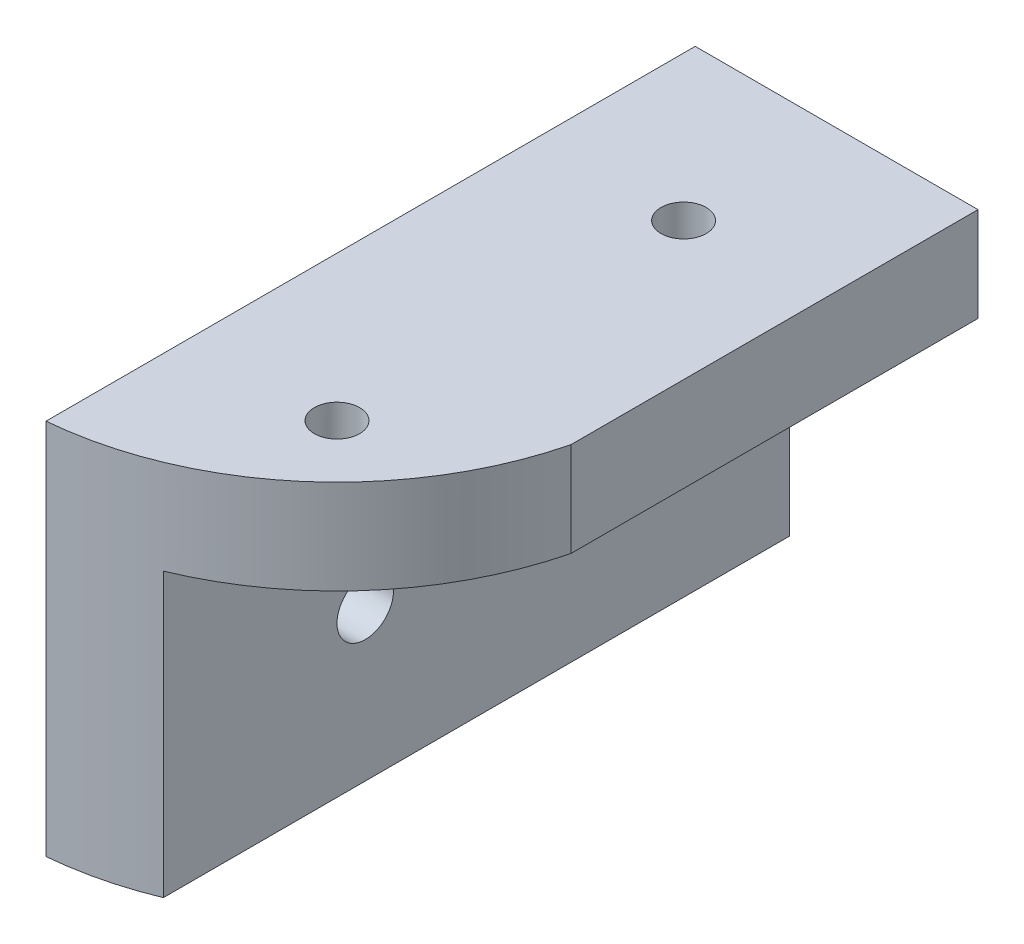
from build123d import *

# Parameters (mm, degrees)
BOSS_EXTRUDE1_DEPTH = 35
CUT_EXTRUDE1_REACH  = 42.927
SKETCH3_R           = 1.2
CUT_EXTRUDE2_REACH  = 43.533
SKETCH4_R           = 1.5
CUT_EXTRUDE4_REACH  = 45.012


with BuildPart() as part:
    # Sketch1 → Boss-Extrude1 (new body)
    with BuildSketch(Plane.XY):
        Polygon((0, 0), (0, 20), (15, 20), (15, 15), (5, 15), (5, 0), align=None)
    extrude(amount=BOSS_EXTRUDE1_DEPTH)

    # Sketch3 → Cut-Extrude1 (cut, up to next)
    with BuildSketch(Plane.XZ.offset(-15), mode=Mode.PRIVATE) as cut_extrude1_sk1:
        with Locations((7.692388155, 26.692388155)):
            Circle(SKETCH3_R)
    cut_extrude1_tool1 = extrude(cut_extrude1_sk1.sketch, amount=-CUT_EXTRUDE1_REACH, mode=Mode.PRIVATE) & part.part
    # Sketch3 → Cut-Extrude1 (cut, up to next)
    with BuildSketch(Plane.XZ.offset(-15), mode=Mode.PRIVATE) as cut_extrude1_sk2:
        with Locations((7.692388155, 8.307611845)):
            Circle(SKETCH3_R)
    cut_extrude1_tool2 = extrude(cut_extrude1_sk2.sketch, amount=-CUT_EXTRUDE1_REACH, mode=Mode.PRIVATE) & part.part
    add(cut_extrude1_tool1.solids().sort_by_distance((7.692388, 15, 26.692388))[0], mode=Mode.SUBTRACT)
    add(cut_extrude1_tool2.solids().sort_by_distance((7.692388, 15, 8.307612))[0], mode=Mode.SUBTRACT)

    # Sketch4 → Cut-Extrude2 (cut, up to next)
    with BuildSketch(Plane(origin=(5, 0, 0), x_dir=(0, 0, -1), z_dir=(1, 0, 0)), mode=Mode.PRIVATE) as cut_extrude2_sk1:
        with Locations(Location((-22.5, 8, 0), (0, 0, 90))):
            Circle(SKETCH4_R)
    cut_extrude2_tool1 = extrude(cut_extrude2_sk1.sketch, amount=-CUT_EXTRUDE2_REACH, mode=Mode.PRIVATE) & part.part
    # Sketch4 → Cut-Extrude2 (cut, up to next)
    with BuildSketch(Plane(origin=(5, 0, 0), x_dir=(0, 0, -1), z_dir=(1, 0, 0)), mode=Mode.PRIVATE) as cut_extrude2_sk2:
        with Locations(Location((-12.5, 8, 0), (0, 0, 90))):
            Circle(SKETCH4_R)
    cut_extrude2_tool2 = extrude(cut_extrude2_sk2.sketch, amount=-CUT_EXTRUDE2_REACH, mode=Mode.PRIVATE) & part.part
    add(cut_extrude2_tool1.solids().sort_by_distance((5, 8, 22.5))[0], mode=Mode.SUBTRACT)
    add(cut_extrude2_tool2.solids().sort_by_distance((5, 8, 12.5))[0], mode=Mode.SUBTRACT)

    # Sketch6 → Cut-Extrude4 (cut, up to next)
    with BuildSketch(Plane(origin=(0, 20, 0), x_dir=(1, 0, 0), z_dir=(0, 1, 0)), mode=Mode.PRIVATE) as cut_extrude4_sk1:
        with BuildLine():
            Line((-1.5, -34.5), (-1.5, -42.5))
            ThreePointArc((-1.5, -42.5), (16.17766953, -35.17766953), (23.5, -17.5))
            Line((23.5, -17.5), (15.5, -17.5))
            ThreePointArc((15.5, -17.5), (10.52081528, -29.52081528), (-1.5, -34.5))
        make_face()
    cut_extrude4_tool1 = extrude(cut_extrude4_sk1.sketch, amount=-CUT_EXTRUDE4_REACH, mode=Mode.PRIVATE) & part.part
    add(cut_extrude4_tool1.solids().sort_by_distance((12.030696, 20, 31.030696))[0], mode=Mode.SUBTRACT)


solid = part.part
